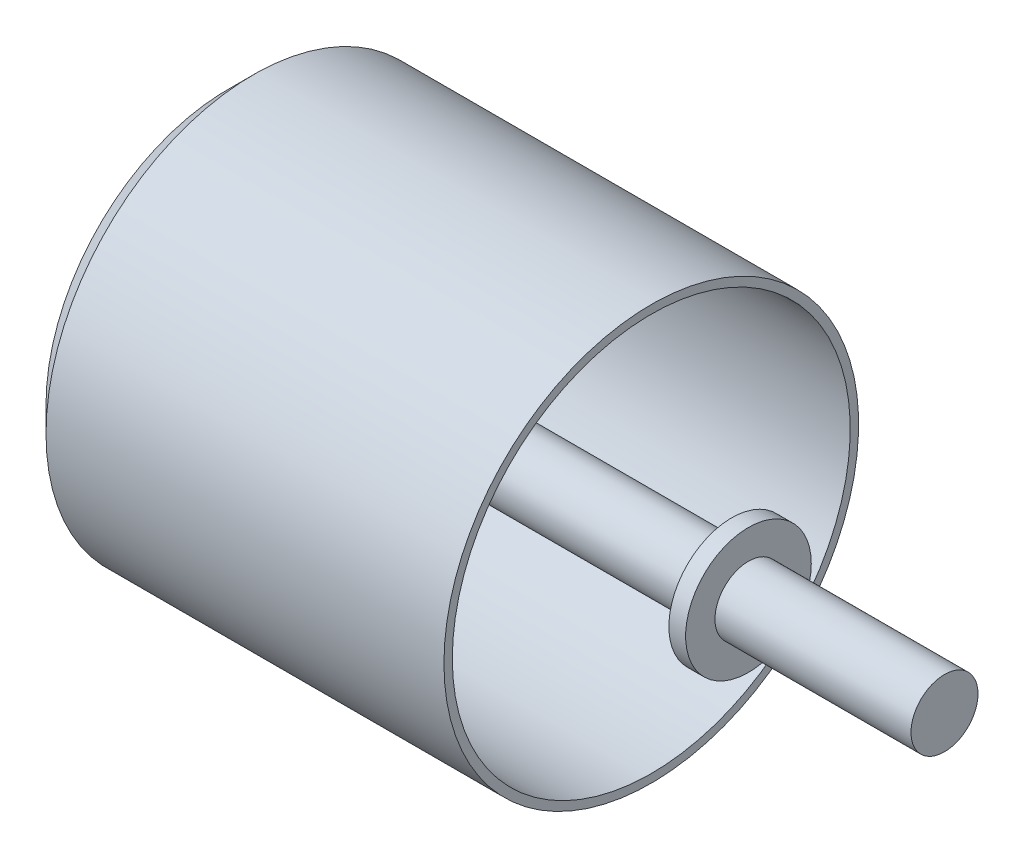
from build123d import *

# Parameters (mm, degrees)
SKETCH2_R           = 4
BOSS_EXTRUDE1_DEPTH = 85.5
SKETCH3_R           = 3.5
CUT_EXTRUDE1_DEPTH  = 93.387093254
SKETCH4_R           = 7.5
BOSS_EXTRUDE2_DEPTH = 2


with BuildPart() as part:
    # Sketch1 → Revolve1 (revolve)
    with BuildSketch(Plane.XY, mode=Mode.PRIVATE) as revolve1_sk:
        Polygon((0, 21.75), (3, 24.75), (50.5, 24.75), (50.5, 23.75), (3.414213562, 23.75), (1, 21.335786438), (1, 0), (0, 0), align=None)
    revolve(revolve1_sk.sketch.rotate(Axis((0, 0, 0), (1, 0, 0)), 90), axis=Axis((0, 0, 0), (1, 0, 0)))

    # Sketch2 → Boss-Extrude1 (add)
    with BuildSketch(Plane(origin=(0, 0, 0), x_dir=(0, 0, -1), z_dir=(1, 0, 0))):
        with Locations(Location((0, 0, 0), (0, 0, 180))):
            Circle(SKETCH2_R)
    extrude(amount=BOSS_EXTRUDE1_DEPTH)

    # Sketch3 → Cut-Extrude1 (cut, through all)
    with BuildSketch(Plane.ZY):
        with Locations((0, 17)):
            Circle(SKETCH3_R)
        with Locations((17, 0)):
            Circle(SKETCH3_R)
        with Locations((0, -17)):
            Circle(SKETCH3_R)
        with Locations((-17, 0)):
            Circle(SKETCH3_R)
    extrude(amount=-CUT_EXTRUDE1_DEPTH, mode=Mode.SUBTRACT)

    # Sketch4 → Boss-Extrude2 (add)
    with BuildSketch(Plane(origin=(60.1, 0, 0), x_dir=(0, 0, -1), z_dir=(1, 0, 0))):
        Circle(SKETCH4_R)
    extrude(amount=BOSS_EXTRUDE2_DEPTH)


solid = part.part
